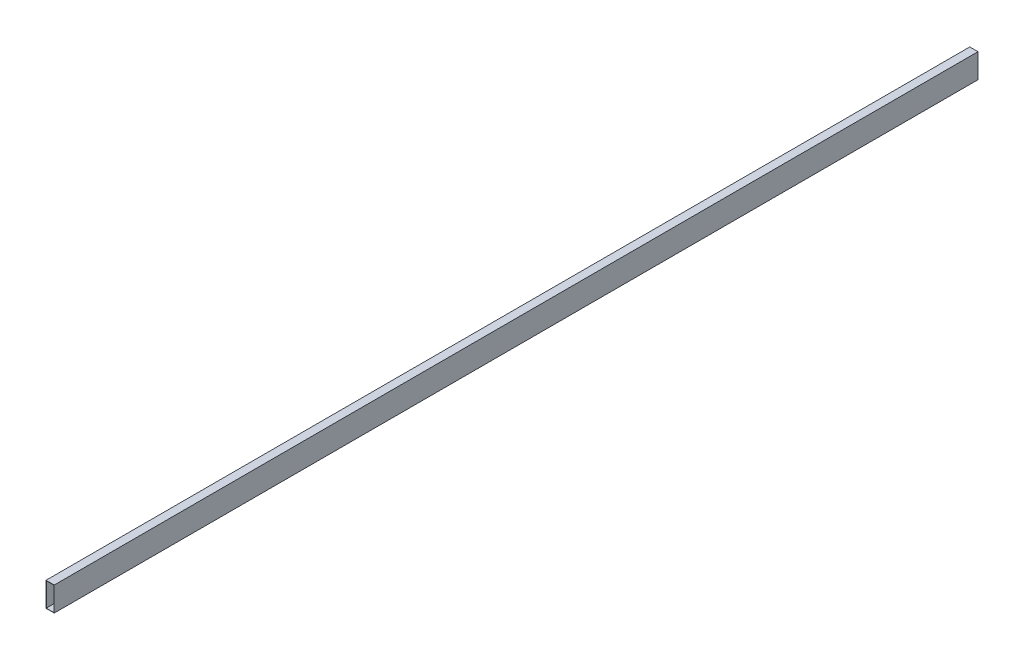
from build123d import *

# Parameters (mm, degrees)
SKETCH1_W           = 13.589
SKETCH1_H           = 40.104767143
SKETCH1_W_2         = 12.7
SKETCH1_H_2         = 39.215767143
BOSS_EXTRUDE1_DEPTH = 1524


with BuildPart() as part:
    # Sketch1 → Boss-Extrude1 (new body)
    with BuildSketch(Plane.XY):
        with Locations((6535.318977879, 4637.234657146)):
            Rectangle(SKETCH1_W, SKETCH1_H)
        with Locations((6535.318977879, 4637.234657146)):
            Rectangle(SKETCH1_W_2, SKETCH1_H_2, mode=Mode.SUBTRACT)
    extrude(amount=BOSS_EXTRUDE1_DEPTH)


solid = part.part
